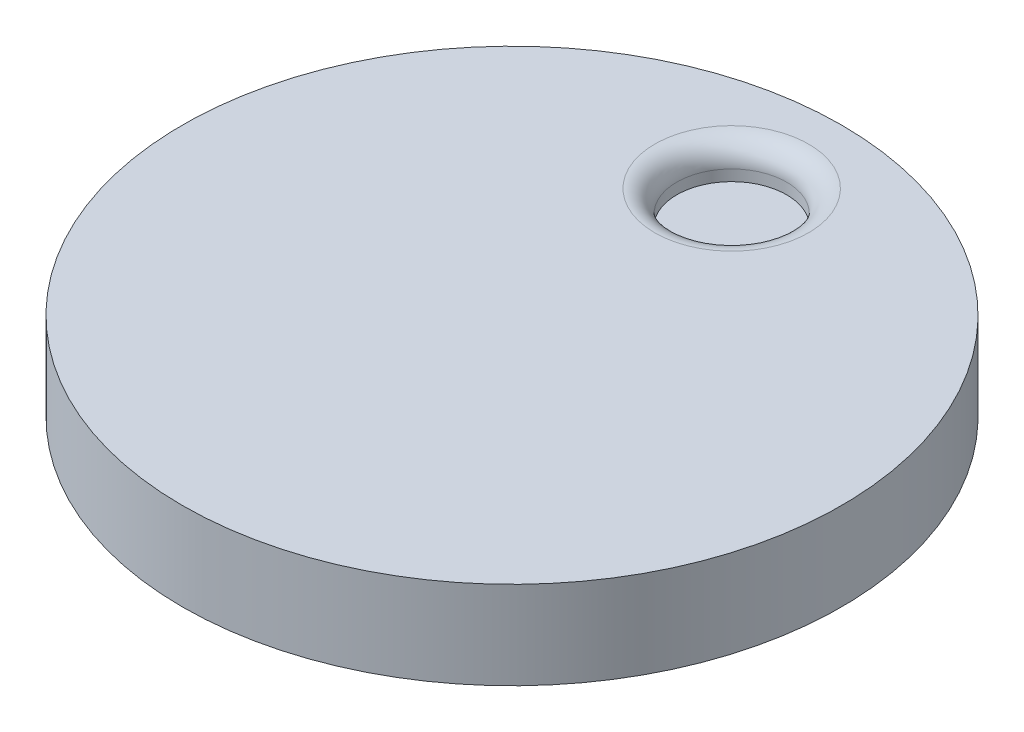
from build123d import *

# Parameters (mm, degrees)
CROQUIS1_R              = 30
SALIENTE_EXTRUIR1_DEPTH = 8
CROQUIS2_R              = 5
CORTAR_EXTRUIR1_DEPTH   = 3
REDONDEO1_R             = 2


with BuildPart() as part:
    # Croquis1 → Saliente-Extruir1 (new body)
    with BuildSketch(Plane(origin=(0, 0, 0), x_dir=(1, 0, 0), z_dir=(0, 1, 0))):
        with Locations(Location((0, 0, 0), (0, 0, 270))):
            Circle(CROQUIS1_R)
    extrude(amount=SALIENTE_EXTRUIR1_DEPTH)

    # Croquis2 → Cortar-Extruir1 (cut)
    with BuildSketch(Plane(origin=(0, 8, 0), x_dir=(1, 0, 0), z_dir=(0, 1, 0))):
        with Locations(Location((0, 20, 0), (0, 0, 270))):
            Circle(CROQUIS2_R)
    extrude(amount=-CORTAR_EXTRUIR1_DEPTH, mode=Mode.SUBTRACT)

    # Redondeo1
    redondeo1_edges = [part.edges().sort_by_distance(p)[0] for p in [
        (0, 8, -25),
    ]]
    fillet(redondeo1_edges, radius=REDONDEO1_R)


solid = part.part
